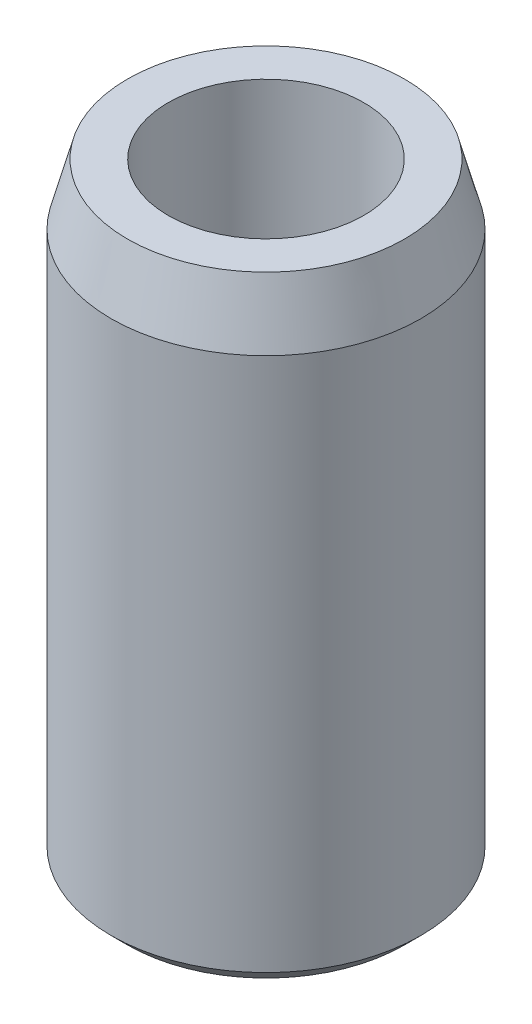
from build123d import *

# Parameters (mm, degrees)
SKETCH1_R           = 19
SKETCH1_R_2         = 12
BOSS_EXTRUDE1_DEPTH = 75
CHAMFER1_SIZE       = 2
CHAMFER1_SIZE2      = 7.464101615
CHAMFER2_SIZE       = 2


with BuildPart() as part:
    # Sketch1 → Boss-Extrude1 (new body)
    with BuildSketch(Plane(origin=(0, 0, 0), x_dir=(1, 0, 0), z_dir=(0, 1, 0))):
        with Locations(Location((0, 0, 0), (0, 0, 270))):
            Circle(SKETCH1_R)
        with Locations(Location((0, 0, 0), (0, 0, 270))):
            Circle(SKETCH1_R_2, mode=Mode.SUBTRACT)
    extrude(amount=-BOSS_EXTRUDE1_DEPTH)

    # Chamfer1
    chamfer1_edges = [part.edges().sort_by_distance(p)[0] for p in [
        (0, 0, -19),
    ]]
    chamfer1_side = [part.faces().sort_by_distance(p)[0] for p in [
        (0, 0, -18.462598846),
    ]]
    chamfer(chamfer1_edges, length=CHAMFER1_SIZE, length2=CHAMFER1_SIZE2, reference=chamfer1_side[0])

    # Chamfer2
    chamfer2_edges = [part.edges().sort_by_distance(p)[0] for p in [
        (0, -75, -19),
    ]]
    chamfer(chamfer2_edges, length=CHAMFER2_SIZE)


solid = part.part
